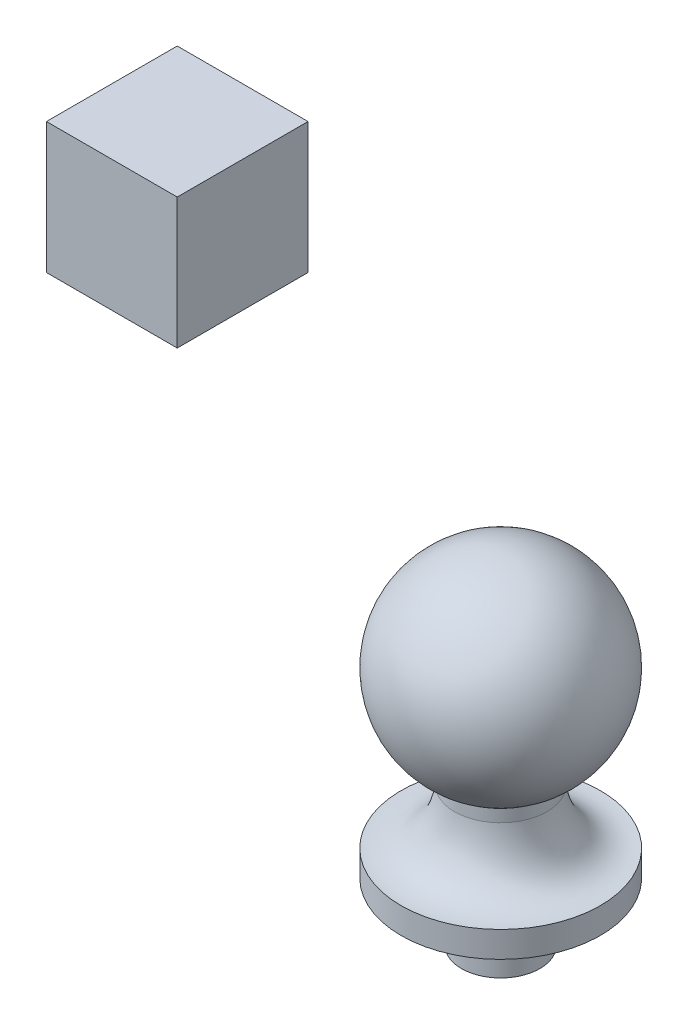
from build123d import *

# Parameters (mm, degrees)
SKETCH1_W           = 10
SKETCH1_H           = 15
SCALE1_SCALE        = 0.3
SKETCH5_W           = 10
SKETCH5_H           = 10
BOSS_EXTRUDE1_DEPTH = 5


with BuildPart() as part:
    # Sketch1 → Revolve2 (revolve)
    with BuildSketch(Plane(origin=(0, 0, 0), x_dir=(0, 0, -1), z_dir=(1, 0, 0))):
        with BuildLine():
            Line((0, 25.4), (0, -25.4))
            ThreePointArc((0, -25.4), (-25.4, 0), (0, 25.4))
        make_face()
        with BuildLine():
            Line((0, -46.453146802), (0, -25.4))
            ThreePointArc((0, -25.4), (-6.051284035, -24.668643285), (-11.754091911, -22.516689884))
            Line((-11.754091911, -22.516689884), (-11.754091911, -25.953962773))
            add(Edge.make_bspline(
                [(-11.754091911, -25.953962773), (-13.625124372, -40.663791469), (-25.4, -39.846348213)],
                knots=[0, 0, 0, 1, 1, 1], degree=2))
            Line((-25.4, -39.846348213), (-25.4, -46.453146802))
            Line((-25.4, -46.453146802), (-10, -46.453146802))
            Line((-10, -46.453146802), (0, -46.453146802))
        make_face()
        with Locations((-5, -53.953146802)):
            Rectangle(SKETCH1_W, SKETCH1_H)
    revolve(axis=Axis((0, 38.955963628, 0), (0, -1, 0)))


with BuildPart() as part_1:
    # Scale1: scaled about (0, -12.091541088, 0)
    add(part.part.scale(SCALE1_SCALE).moved(Location((0, -8.464078762, 0))))


with BuildPart() as body_2:
    # Sketch5 → Boss-Extrude1 (new, symmetric)
    with BuildSketch(Plane.XY):
        with Locations((-24.731084823, 10.325763219)):
            Rectangle(SKETCH5_W, SKETCH5_H)
    extrude(amount=BOSS_EXTRUDE1_DEPTH, both=True)


solid = Compound([part_1.part, body_2.part])
